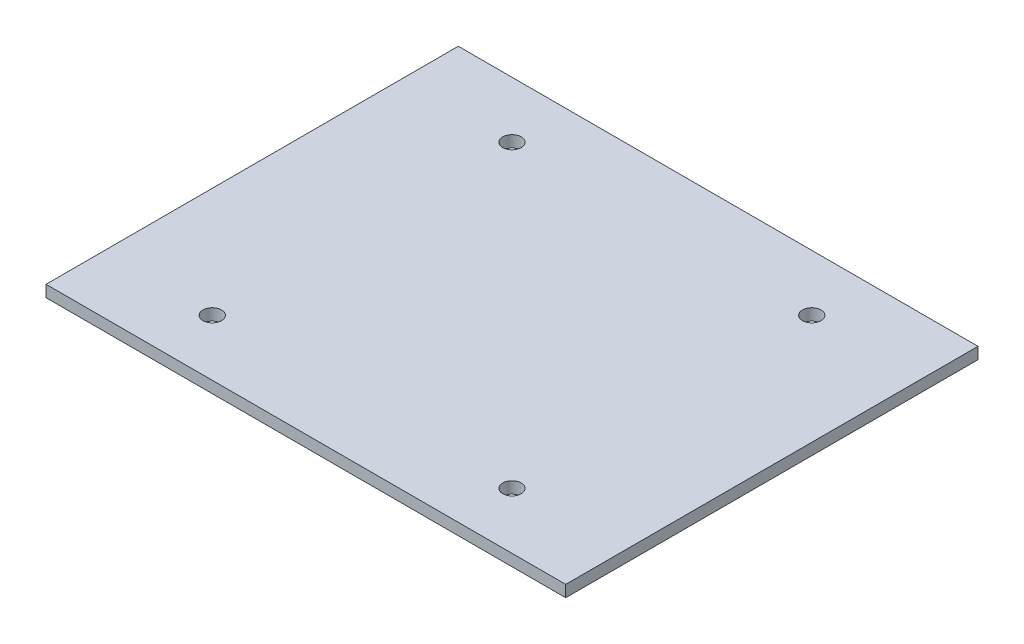
from build123d import *

# Parameters (mm, degrees)
SKETCH1_W           = 89.5
SKETCH1_H           = 71
SKETCH1_R           = 1.6
BOSS_EXTRUDE1_DEPTH = 2


with BuildPart() as part:
    # Sketch1 → Boss-Extrude1 (new body)
    with BuildSketch(Plane(origin=(0, 0, 0), x_dir=(1, 0, 0), z_dir=(0, 1, 0))):
        with Locations((-6.674961592, -47.697715994)):
            Rectangle(SKETCH1_W, SKETCH1_H)
        with Locations(Location((19.134435922, -73.507113507, 0), (0, 0, 270))):
            Circle(SKETCH1_R, mode=Mode.SUBTRACT)
        with Locations(Location((-32.484359105, -73.507113507, 0), (0, 0, 270))):
            Circle(SKETCH1_R, mode=Mode.SUBTRACT)
        with Locations(Location((-32.484359105, -21.88831848, 0), (0, 0, 270))):
            Circle(SKETCH1_R, mode=Mode.SUBTRACT)
        with Locations(Location((19.134435922, -21.88831848, 0), (0, 0, 270))):
            Circle(SKETCH1_R, mode=Mode.SUBTRACT)
    extrude(amount=BOSS_EXTRUDE1_DEPTH)


solid = part.part
